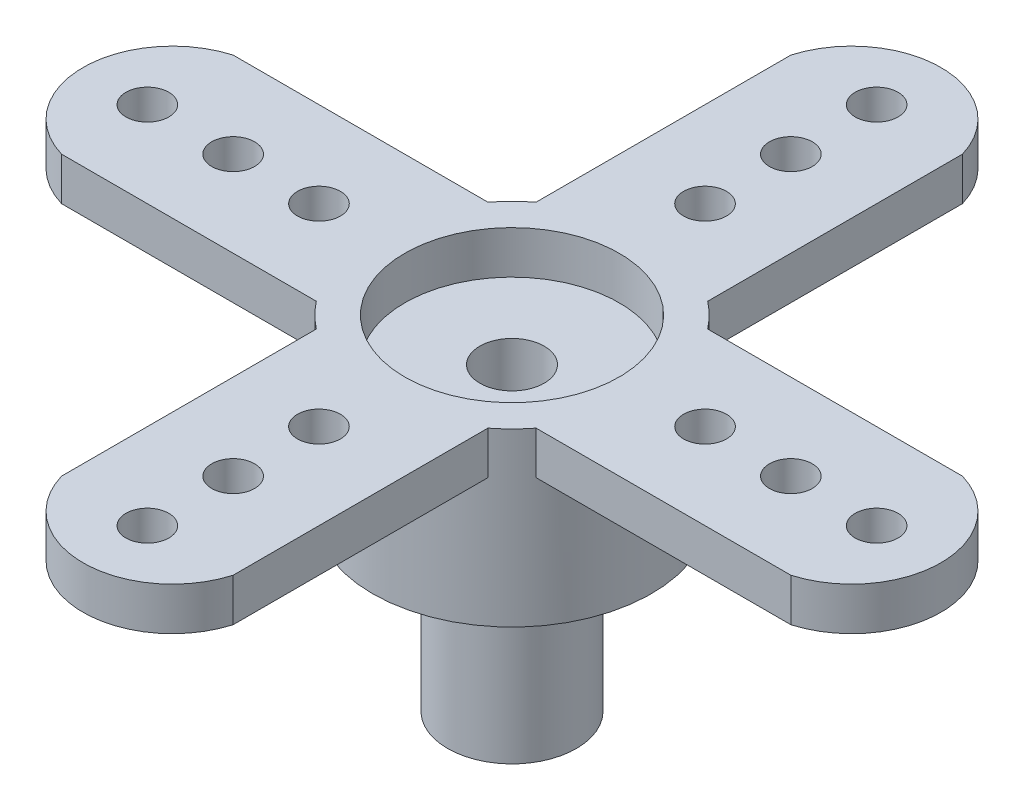
from build123d import *

# Parameters (mm, degrees)
ESQUISSE1_R                            = 1.5
BOSS_EXTRU_1_DEPTH                     = 4
ESQUISSE2_R                            = 3.25
BOSS_EXTRU_2_DEPTH                     = 4
BOSS_EXTRU_3_START                     = -1
BOSS_EXTRU_3_DEPTH                     = 1
R_P_TITION_CIRCULAIRE6_COUNT           = 4
ESQUISSE5_R                            = 0.5
ENL_V_MAT_EXTRU_1_DEPTH                = 1
R_P_TITION_LIN_AIRE1_COUNT             = 3
R_P_TITION_LIN_AIRE1_PITCH             = 2
R_P_TITION_CIRCULAIRE7_COUNT           = 4
R_P_TITION_CIRCULAIRE7_COPY_1_SKETCH_R = 0.5
R_P_TITION_CIRCULAIRE7_COPY_1_DEPTH    = 1
R_P_TITION_CIRCULAIRE7_COPY_2_SKETCH_R = 0.5
R_P_TITION_CIRCULAIRE7_COPY_2_DEPTH    = 1
R_P_TITION_CIRCULAIRE7_COPY_3_SKETCH_R = 0.5
R_P_TITION_CIRCULAIRE7_COPY_3_DEPTH    = 1
R_P_TITION_CIRCULAIRE7_COPY_4_SKETCH_R = 0.5
R_P_TITION_CIRCULAIRE7_COPY_4_DEPTH    = 1
R_P_TITION_CIRCULAIRE7_COPY_5_SKETCH_R = 0.5
R_P_TITION_CIRCULAIRE7_COPY_5_DEPTH    = 1
R_P_TITION_CIRCULAIRE7_COPY_6_SKETCH_R = 0.5
R_P_TITION_CIRCULAIRE7_COPY_6_DEPTH    = 1
ESQUISSE6_R                            = 2.5
ENL_V_MAT_EXTRU_2_DEPTH                = 1
ESQUISSE7_R                            = 0.75
ENL_V_MAT_EXTRU_3_DEPTH                = 2


with BuildPart() as part:
    # Esquisse1 → Boss.-Extru.1 (new body)
    with BuildSketch(Plane(origin=(0, 0, 0), x_dir=(1, 0, 0), z_dir=(0, 1, 0))):
        with Locations(Location((0, 0, 0), (0, 0, 270))):
            Circle(ESQUISSE1_R)
    extrude(amount=BOSS_EXTRU_1_DEPTH)

    # Esquisse2 → Boss.-Extru.2 (add)
    with BuildSketch(Plane(origin=(0, 4, 0), x_dir=(1, 0, 0), z_dir=(0, 1, 0))):
        with Locations(Location((0, 0, 0), (0, 0, 270))):
            Circle(ESQUISSE2_R)
    extrude(amount=BOSS_EXTRU_2_DEPTH)

    # Esquisse3 → Boss.-Extru.3 (add)
    with BuildSketch(Plane(origin=(0, 8, 0), x_dir=(1, 0, 0), z_dir=(0, 1, 0)).offset(BOSS_EXTRU_3_START)):
        with BuildLine():
            ThreePointArc((-2, -8.5), (-1.25, -9.583333333), (0, -10))
            ThreePointArc((0, -10), (1.25, -9.583333333), (2, -8.5))
            Line((2, -8.5), (2, -2.561737691))
            ThreePointArc((2, -2.561737691), (0, -3.25), (-2, -2.561737691))
            Line((-2, -2.561737691), (-2, -8.5))
        make_face()
    boss_extru_3 = extrude(amount=BOSS_EXTRU_3_DEPTH)

    # Répétition circulaire6: Boss.-Extru.3 ×4 about axis
    r_p_tition_circulaire6_axis = Axis((0, 0, 0), (0, 1, 0))
    for i in range(1, R_P_TITION_CIRCULAIRE6_COUNT):
        add(boss_extru_3.rotate(r_p_tition_circulaire6_axis, i * 360 / R_P_TITION_CIRCULAIRE6_COUNT))

    # Esquisse5 → Enlèv. mat.-Extru.1 (cut)
    with BuildSketch(Plane(origin=(0, 8, 0), x_dir=(1, 0, 0), z_dir=(0, 1, 0))):
        with Locations(Location((0, -8.5, 0), (0, 0, 270))):
            Circle(ESQUISSE5_R)
    enl_v_mat_extru_1 = extrude(amount=-ENL_V_MAT_EXTRU_1_DEPTH, mode=Mode.SUBTRACT)

    # Répétition linéaire1: Enlèv. mat.-Extru.1 ×3
    with Locations(*[(0, 0, -i * R_P_TITION_LIN_AIRE1_PITCH) for i in range(1, R_P_TITION_LIN_AIRE1_COUNT)]):
        add(enl_v_mat_extru_1, mode=Mode.SUBTRACT)

    # Répétition circulaire7: Enlèv. mat.-Extru.1 ×4 about axis
    r_p_tition_circulaire7_axis = Axis((0, 0, 0), (0, 1, 0))
    for i in range(1, R_P_TITION_CIRCULAIRE7_COUNT):
        add(enl_v_mat_extru_1.rotate(r_p_tition_circulaire7_axis, i * 360 / R_P_TITION_CIRCULAIRE7_COUNT), mode=Mode.SUBTRACT)

    # Répétition circulaire7 copy 1 sketch → Répétition circulaire7 copy 1 (cut)
    with BuildSketch(Plane(origin=(-2, 8, 0), x_dir=(0, 0, -1), z_dir=(0, 1, 0))):
        with Locations(Location((0, -8.5, 0), (0, 0, 270))):
            Circle(R_P_TITION_CIRCULAIRE7_COPY_1_SKETCH_R)
    extrude(amount=-R_P_TITION_CIRCULAIRE7_COPY_1_DEPTH, mode=Mode.SUBTRACT)

    # Répétition circulaire7 copy 2 sketch → Répétition circulaire7 copy 2 (cut)
    with BuildSketch(Plane(origin=(0, 8, 2), x_dir=(-1, 0, 0), z_dir=(0, 1, 0))):
        with Locations(Location((0, -8.5, 0), (0, 0, 270))):
            Circle(R_P_TITION_CIRCULAIRE7_COPY_2_SKETCH_R)
    extrude(amount=-R_P_TITION_CIRCULAIRE7_COPY_2_DEPTH, mode=Mode.SUBTRACT)

    # Répétition circulaire7 copy 3 sketch → Répétition circulaire7 copy 3 (cut)
    with BuildSketch(Plane(origin=(2, 8, 0), x_dir=(0, 0, 1), z_dir=(0, 1, 0))):
        with Locations(Location((0, -8.5, 0), (0, 0, 270))):
            Circle(R_P_TITION_CIRCULAIRE7_COPY_3_SKETCH_R)
    extrude(amount=-R_P_TITION_CIRCULAIRE7_COPY_3_DEPTH, mode=Mode.SUBTRACT)

    # Répétition circulaire7 copy 4 sketch → Répétition circulaire7 copy 4 (cut)
    with BuildSketch(Plane(origin=(-4, 8, 0), x_dir=(0, 0, -1), z_dir=(0, 1, 0))):
        with Locations(Location((0, -8.5, 0), (0, 0, 270))):
            Circle(R_P_TITION_CIRCULAIRE7_COPY_4_SKETCH_R)
    extrude(amount=-R_P_TITION_CIRCULAIRE7_COPY_4_DEPTH, mode=Mode.SUBTRACT)

    # Répétition circulaire7 copy 5 sketch → Répétition circulaire7 copy 5 (cut)
    with BuildSketch(Plane(origin=(0, 8, 4), x_dir=(-1, 0, 0), z_dir=(0, 1, 0))):
        with Locations(Location((0, -8.5, 0), (0, 0, 270))):
            Circle(R_P_TITION_CIRCULAIRE7_COPY_5_SKETCH_R)
    extrude(amount=-R_P_TITION_CIRCULAIRE7_COPY_5_DEPTH, mode=Mode.SUBTRACT)

    # Répétition circulaire7 copy 6 sketch → Répétition circulaire7 copy 6 (cut)
    with BuildSketch(Plane(origin=(4, 8, 0), x_dir=(0, 0, 1), z_dir=(0, 1, 0))):
        with Locations(Location((0, -8.5, 0), (0, 0, 270))):
            Circle(R_P_TITION_CIRCULAIRE7_COPY_6_SKETCH_R)
    extrude(amount=-R_P_TITION_CIRCULAIRE7_COPY_6_DEPTH, mode=Mode.SUBTRACT)

    # Esquisse6 → Enlèv. mat.-Extru.2 (cut)
    with BuildSketch(Plane(origin=(0, 8, 0), x_dir=(1, 0, 0), z_dir=(0, 1, 0))):
        with Locations(Location((0, 0, 0), (0, 0, 270))):
            Circle(ESQUISSE6_R)
    extrude(amount=-ENL_V_MAT_EXTRU_2_DEPTH, mode=Mode.SUBTRACT)

    # Esquisse7 → Enlèv. mat.-Extru.3 (cut)
    with BuildSketch(Plane(origin=(0, 7, 0), x_dir=(1, 0, 0), z_dir=(0, 1, 0))):
        with Locations(Location((0, 0, 0), (0, 0, 270))):
            Circle(ESQUISSE7_R)
    extrude(amount=-ENL_V_MAT_EXTRU_3_DEPTH, mode=Mode.SUBTRACT)


solid = part.part
